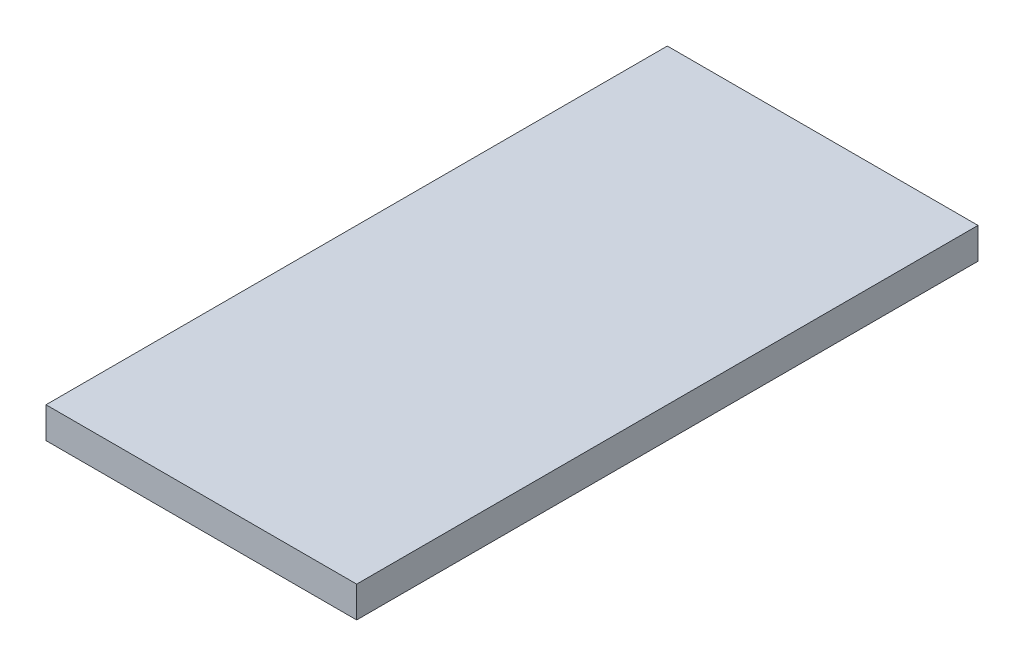
from build123d import *

# Parameters (mm, degrees)
SKETCH1_W           = 10
SKETCH1_H           = 20
BOSS_EXTRUDE1_DEPTH = 1


with BuildPart() as part:
    # Sketch1 → Boss-Extrude1 (new body)
    with BuildSketch(Plane(origin=(0, 0, 0), x_dir=(1, 0, 0), z_dir=(0, 1, 0))):
        with Locations((5, -10)):
            Rectangle(SKETCH1_W, SKETCH1_H)
    extrude(amount=BOSS_EXTRUDE1_DEPTH)


solid = part.part
